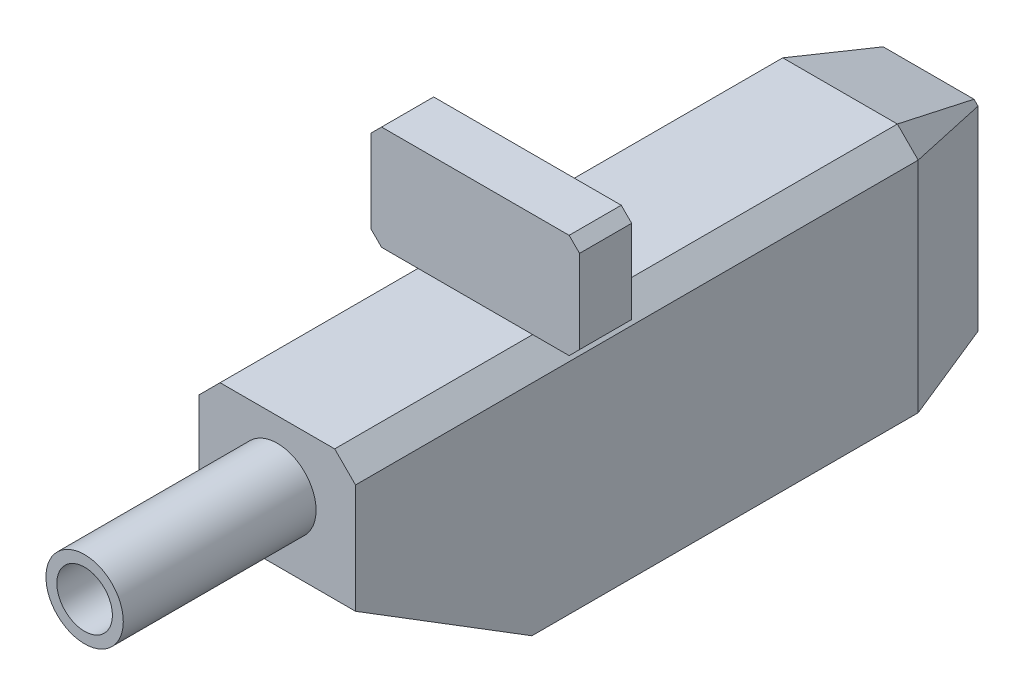
from build123d import *

# Parameters (mm, degrees)
BOSS_EXTRUDE1_DEPTH = 108
SKETCH2_R           = 7.424298736
SKETCH2_R_2         = 5.332436938
BOSS_EXTRUDE2_DEPTH = 37
BOSS_EXTRUDE3_DEPTH = 10
CUT_EXTRUDE1_REACH  = 157.804
BOSS_EXTRUDE5_DEPTH = 17
BOSS_EXTRUDE5_TAPER = 18


with BuildPart() as part:
    # Sketch1 → Boss-Extrude1 (new body)
    with BuildSketch(Plane.XY):
        Polygon((-11, 25), (-15, 21), (-15, -21), (-11, -25), (11, -25), (15, -21), (15, 21), (11, 25), align=None)
    extrude(amount=BOSS_EXTRUDE1_DEPTH)

    # Sketch2 → Boss-Extrude2 (add)
    with BuildSketch(Plane.XY.offset(108)):
        with Locations((0, 13.003641212)):
            Circle(SKETCH2_R)
        with Locations((0, 13.003641212)):
            Circle(SKETCH2_R_2, mode=Mode.SUBTRACT)
    extrude(amount=BOSS_EXTRUDE2_DEPTH)

    # Sketch3 → Boss-Extrude3 (add)
    with BuildSketch(Plane(origin=(0, 0, 70), x_dir=(-1, 0, 0), z_dir=(0, 0, -1))):
        Polygon((-18, 45), (18, 45), (20, 43), (20, 27), (18, 25), (-18, 25), (-20, 27), (-20, 43), align=None)
    extrude(amount=BOSS_EXTRUDE3_DEPTH)

    # Sketch4 → Cut-Extrude1 (cut, up to next)
    with BuildSketch(Plane.ZY.offset(15), mode=Mode.PRIVATE) as cut_extrude1_sk1:
        Polygon((108, 0), (67.685614015, -25), (108, -25), align=None)
    cut_extrude1_tool1 = extrude(cut_extrude1_sk1.sketch, amount=-CUT_EXTRUDE1_REACH, mode=Mode.PRIVATE) & part.part
    add(cut_extrude1_tool1.solids().sort_by_distance((-15, -16.666667, 94.561871))[0], mode=Mode.SUBTRACT)

    # Sketch5 → Boss-Extrude5 (add)
    with BuildSketch(Plane(origin=(-28.517335014, 0, 0), x_dir=(-1, 0, 0), z_dir=(0, 0, -1))):
        Polygon((-43.517335014, 21), (-43.517335014, -21), (-39.517335014, -25), (-17.517335014, -25), (-13.517335014, -21), (-13.517335014, 21), (-17.517335014, 25), (-39.517335014, 25), align=None)
    extrude(amount=BOSS_EXTRUDE5_DEPTH, taper=BOSS_EXTRUDE5_TAPER)


solid = part.part
